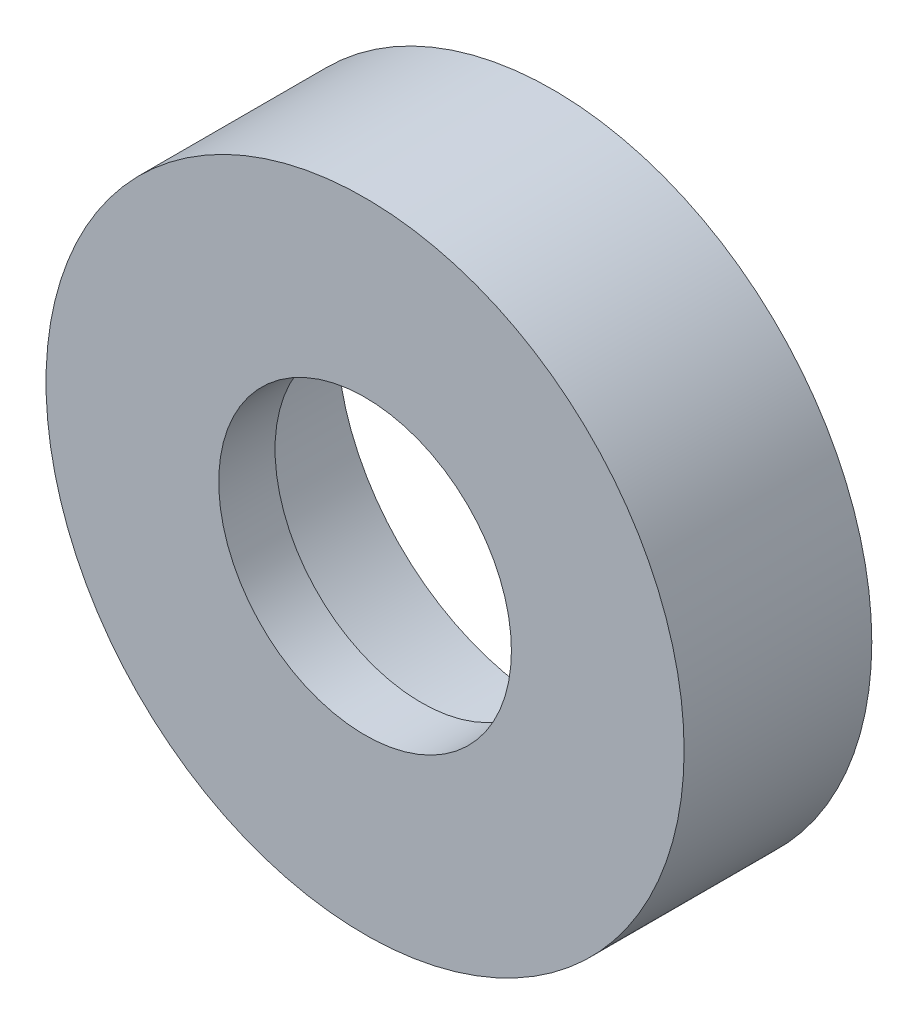
from build123d import *

# Parameters (mm, degrees)
SKETCH_1_R      = 17
SKETCH_1_R_2    = 11.5
EXTRUDE_1_DEPTH = 10
EXTRUDE_START   = -3
SKETCH_2_R      = 11.5
SKETCH_2_R_2    = 7.797228866
EXTRUDE_2_DEPTH = 3


with BuildPart() as part:
    # Эскиз1 → Бобышка-Вытянуть1 (new body)
    with BuildSketch(Plane.XY):
        Circle(SKETCH_1_R)
        Circle(SKETCH_1_R_2, mode=Mode.SUBTRACT)
    extrude(amount=EXTRUDE_1_DEPTH)

    # Эскиз2 → Бобышка-Вытянуть2 (add)
    with BuildSketch(Plane.XY.offset(10).offset(EXTRUDE_START)):
        Circle(SKETCH_2_R)
        Circle(SKETCH_2_R_2, mode=Mode.SUBTRACT)
    extrude(amount=EXTRUDE_2_DEPTH)


solid = part.part
